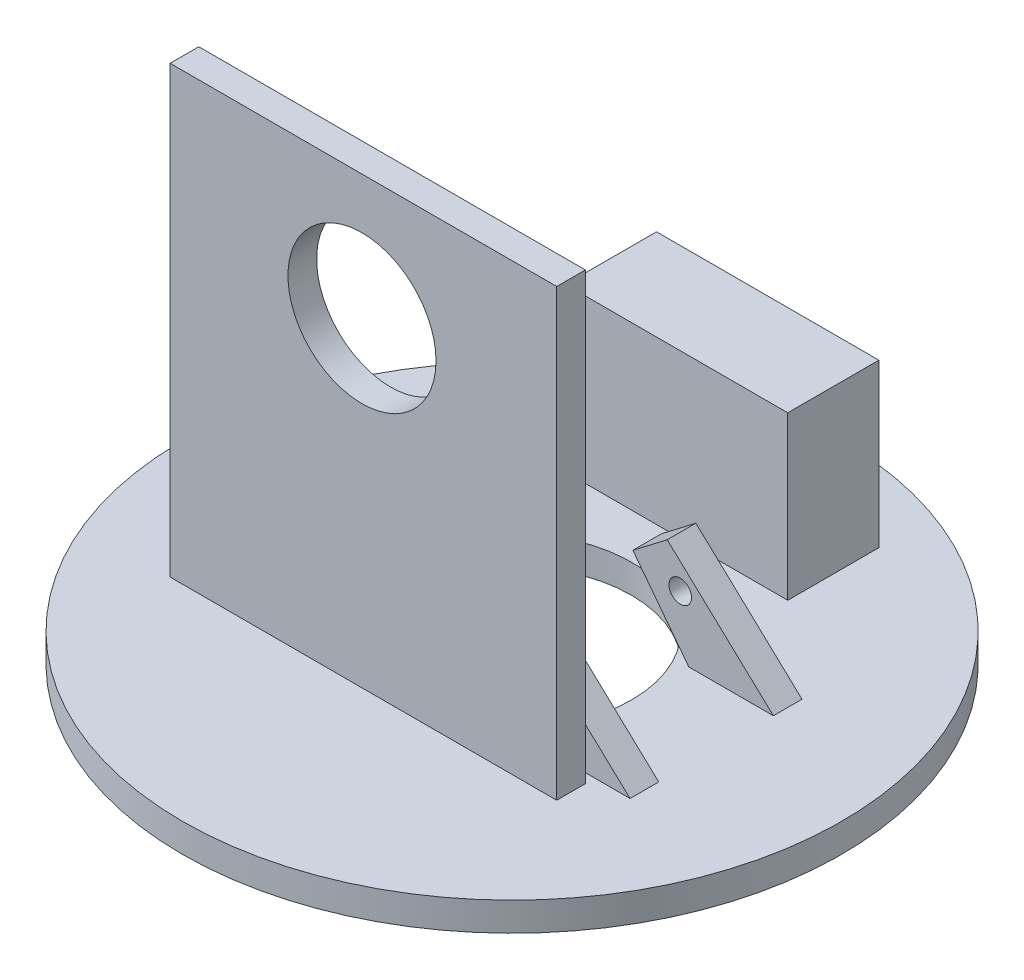
from build123d import *

# Parameters (mm, degrees)
SKETCH_1_R          = 34.5
EXTRUDE_1_DEPTH     = 3
SKETCH_2_R          = 12.5
CUT_EXTRUDE_1_DEPTH = 3
EXTRUDE_START       = 6
SKETCH_3_R          = 1.183017338
EXTRUDE_2_DEPTH     = 3
EXTRUDE_START_2     = -9
SKETCH_3_2_R        = 1.183017338
EXTRUDE_3_DEPTH     = 3
EXTRUDE_START_3     = 10
SKETCH_4_W          = 40.46646749
SKETCH_4_H          = 46.577480255
EXTRUDE_6_DEPTH     = 3
SKETCH_5_R          = 7.75
CUT_EXTRUDE_2_DEPTH = 3
SKETCH_6_W          = 23.274927202
SKETCH_6_H          = 9.540013766
EXTRUDE_7_DEPTH     = 17


with BuildPart() as part:
    # 草图1 → 凸台-拉伸1 (new body)
    with BuildSketch(Plane(origin=(0, 0, 0), x_dir=(1, 0, 0), z_dir=(0, 1, 0))):
        Circle(SKETCH_1_R)
    extrude(amount=EXTRUDE_1_DEPTH)

    # 草图2 → 切除-拉伸1 (cut)
    with BuildSketch(Plane(origin=(0, 3, 0), x_dir=(1, 0, 0), z_dir=(0, 1, 0))):
        Circle(SKETCH_2_R)
    extrude(amount=-CUT_EXTRUDE_1_DEPTH, mode=Mode.SUBTRACT)

    # 草图3 → 凸台-拉伸2 (add)
    with BuildSketch(Plane.XY.offset(EXTRUDE_START)):
        Polygon((-12.5, 3), (-6.645761315, 10.649339614), (-10.240290901, 13.400326656), (-21.352795206, 3), align=None)
        with Locations((-11.606709205, 9.420794795)):
            Circle(SKETCH_3_R, mode=Mode.SUBTRACT)
    extrude_2 = extrude(amount=EXTRUDE_2_DEPTH)

    # 草图3<2> → 凸台-拉伸3 (add)
    with BuildSketch(Plane.XY.offset(EXTRUDE_START_2)):
        Polygon((-12.5, 3), (-6.645761315, 10.649339614), (-10.240290901, 13.400326656), (-21.352795206, 3), align=None)
        with Locations((-11.606709205, 9.420794795)):
            Circle(SKETCH_3_2_R, mode=Mode.SUBTRACT)
    extrude_3 = extrude(amount=EXTRUDE_3_DEPTH)

    # 镜向1: 凸台-拉伸2, 凸台-拉伸3 across plane
    add(extrude_2.mirror(Plane(origin=(0, 0, 0), x_dir=(0, 0, 1), z_dir=(1, 0, 0))))
    add(extrude_3.mirror(Plane(origin=(0, 0, 0), x_dir=(0, 0, 1), z_dir=(1, 0, 0))))

    # 草图4 → 凸台-拉伸6 (add)
    with BuildSketch(Plane.XY.offset(EXTRUDE_START_3)):
        with Locations((-2.561924873, 26.288740128)):
            Rectangle(SKETCH_4_W, SKETCH_4_H)
    extrude(amount=EXTRUDE_6_DEPTH)

    # 草图5 → 切除-拉伸2 (cut)
    with BuildSketch(Plane.XY.offset(13)):
        with Locations((-2.710861026, 36.508686197)):
            Circle(SKETCH_5_R)
    extrude(amount=-CUT_EXTRUDE_2_DEPTH, mode=Mode.SUBTRACT)

    # 草图6 → 凸台-拉伸7 (add)
    with BuildSketch(Plane(origin=(0, 3, 0), x_dir=(1, 0, 0), z_dir=(0, 1, 0))):
        with Locations((0, 21.989393432)):
            Rectangle(SKETCH_6_W, SKETCH_6_H)
    extrude(amount=EXTRUDE_7_DEPTH)


solid = part.part
